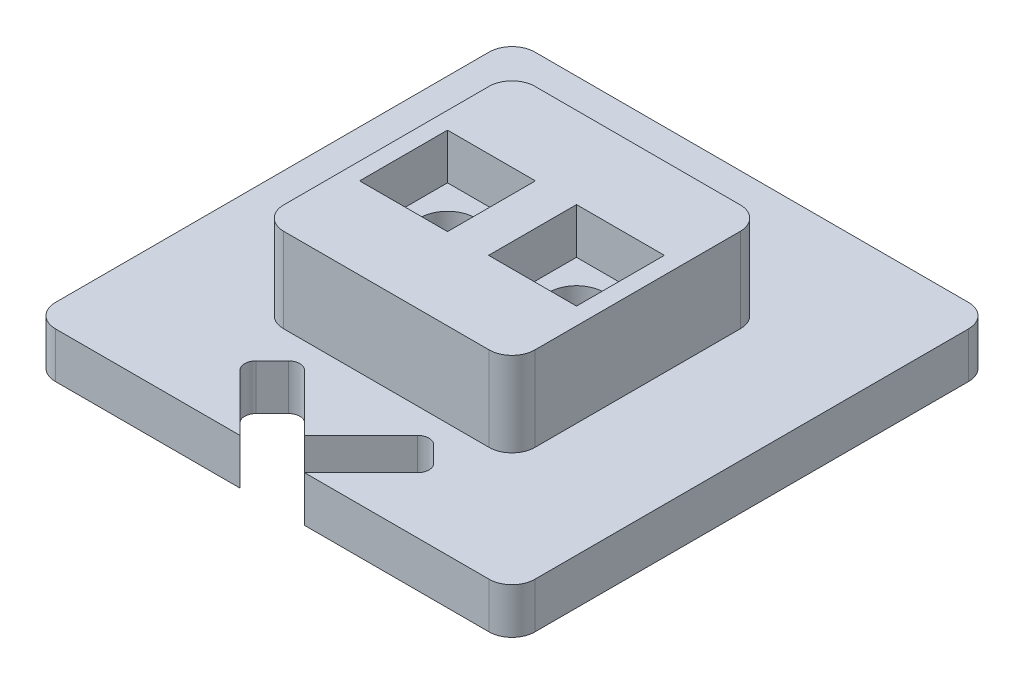
from build123d import *

# Parameters (mm, degrees)
SKETCH1_W           = 11
SKETCH1_H           = 11
BOSS_EXTRUDE1_DEPTH = 3.7
FILLET1_R           = 1
SKETCH2_W           = 3.85
SKETCH2_H           = 3.85
CUT_EXTRUDE1_DEPTH  = 2
SKETCH4_R           = 2.2
BOSS_EXTRUDE2_DEPTH = 2
BOSS_EXTRUDE3_DEPTH = 2
SKETCH3_R           = 1.2
CUT_EXTRUDE2_DEPTH  = 16.90565937
CUT_EXTRUDE3_DEPTH  = 16.303267625


with BuildPart() as part:
    # Sketch1 → Boss-Extrude1 (new body)
    with BuildSketch(Plane(origin=(0, 0, 0), x_dir=(1, 0, 0), z_dir=(0, 1, 0))):
        Rectangle(SKETCH1_W, SKETCH1_H)
    extrude(amount=BOSS_EXTRUDE1_DEPTH)

    # Fillet1
    fillet1_edges = [part.edges().sort_by_distance(p)[0] for p in [
        (5.5, 1.85, 5.5),
        (-5.5, 1.85, 5.5),
        (-5.5, 1.85, -5.5),
        (5.5, 1.85, -5.5),
    ]]
    fillet(fillet1_edges, radius=FILLET1_R)

    # Sketch2 → Cut-Extrude1 (cut)
    with BuildSketch(Plane(origin=(0, 3.7, 0), x_dir=(1, 0, 0), z_dir=(0, 1, 0))):
        with Locations((-2.825, 0)):
            Rectangle(SKETCH2_W, SKETCH2_H)
        with Locations((2.825, 0)):
            Rectangle(SKETCH2_W, SKETCH2_H)
    extrude(amount=-CUT_EXTRUDE1_DEPTH, mode=Mode.SUBTRACT)

    # Sketch4 → Boss-Extrude2 (add)
    with BuildSketch(Plane(origin=(0, 0, 0), x_dir=(-1, 0, 0), z_dir=(0, -1, 0))):
        with Locations(Location((2.825, 0, 0), (0, 0, 90))):
            Circle(SKETCH4_R)
        with Locations(Location((-2.825, 0, 0), (0, 0, 90))):
            Circle(SKETCH4_R)
    extrude(amount=BOSS_EXTRUDE2_DEPTH)

    # Sketch5 → Boss-Extrude3 (add)
    with BuildSketch(Plane(origin=(0, -2, 0), x_dir=(-1, 0, 0), z_dir=(0, -1, 0))):
        with BuildLine():
            Line((9.5, 10.5), (-9.5, 10.5))
            ThreePointArc((-9.5, 10.5), (-10.207106781, 10.207106781), (-10.5, 9.5))
            Line((-10.5, 9.5), (-10.5, -9.5))
            ThreePointArc((-10.5, -9.5), (-10.207106781, -10.207106781), (-9.5, -10.5))
            Line((-9.5, -10.5), (9.5, -10.5))
            ThreePointArc((9.5, -10.5), (10.207106781, -10.207106781), (10.5, -9.5))
            Line((10.5, -9.5), (10.5, 9.5))
            ThreePointArc((10.5, 9.5), (10.207106781, 10.207106781), (9.5, 10.5))
        make_face()
    extrude(amount=-BOSS_EXTRUDE3_DEPTH)

    # Sketch3 → Cut-Extrude2 (cut, through all)
    with BuildSketch(Plane(origin=(0, 3.7, 0), x_dir=(1, 0, 0), z_dir=(0, 1, 0))):
        with Locations(Location((-2.825, 0, 0), (0, 0, 270))):
            Circle(SKETCH3_R)
        with Locations(Location((2.825, 0, 0), (0, 0, 270))):
            Circle(SKETCH3_R)
    extrude(amount=-CUT_EXTRUDE2_DEPTH, mode=Mode.SUBTRACT)

    # Sketch7 → Cut-Extrude3 (cut, through all)
    with BuildSketch(Plane(origin=(0, 0, 0), x_dir=(1, 0, 0), z_dir=(0, 1, 0))):
        with BuildLine():
            Line((0, -9.085786438), (1.414213562, -10.5))
            Line((1.414213562, -10.5), (3.889087297, -8.025126266))
            ThreePointArc((3.889087297, -8.025126266), (4.035533906, -7.671572875), (3.889087297, -7.318019485))
            Line((3.889087297, -7.318019485), (3.181980515, -6.610912703))
            ThreePointArc((3.181980515, -6.610912703), (2.828427125, -6.464466094), (2.474873734, -6.610912703))
            Line((2.474873734, -6.610912703), (0, -9.085786438))
        make_face()
        with BuildLine():
            Line((-3.889087297, -8.025126266), (-1.414213562, -10.5))
            Line((-1.414213562, -10.5), (0, -9.085786438))
            Line((0, -9.085786438), (-2.474873734, -6.610912703))
            ThreePointArc((-2.474873734, -6.610912703), (-2.828427125, -6.464466094), (-3.181980515, -6.610912703))
            Line((-3.181980515, -6.610912703), (-3.889087297, -7.318019485))
            ThreePointArc((-3.889087297, -7.318019485), (-4.035533906, -7.671572875), (-3.889087297, -8.025126266))
        make_face()
        Polygon((-1.414213562, -10.5), (1.414213562, -10.5), (0, -9.085786438), align=None)
    extrude(amount=-CUT_EXTRUDE3_DEPTH, mode=Mode.SUBTRACT)


solid = part.part
